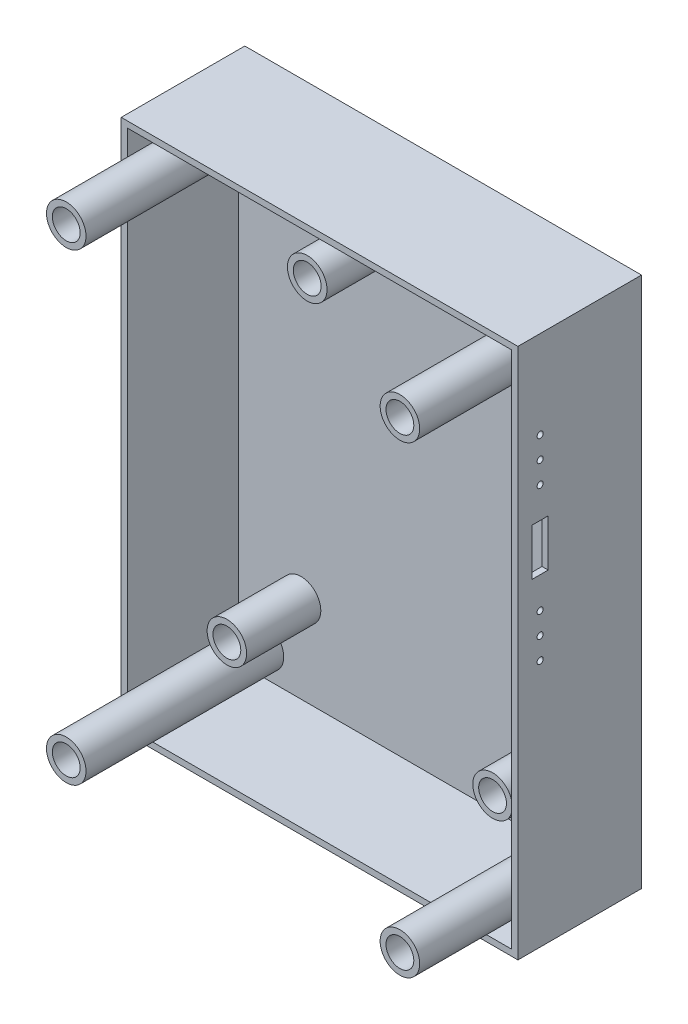
from build123d import *

# Parameters (mm, degrees)
SKETCH_1_W          = 64.2
SKETCH_1_H          = 86
EXTRUDE_1_DEPTH     = 20
SKETCH_2_W          = 62.2
SKETCH_2_H          = 84
CUT_EXTRUDE_1_DEPTH = 18
SKETCH_3_R          = 3.2
EXTRUDE_2_DEPTH     = 12
SKETCH_6_R          = 2.25
CUT_EXTRUDE_4_DEPTH = 8
SKETCH_7_R          = 3.2
EXTRUDE_3_DEPTH     = 32
SKETCH_8_R          = 2.25
CUT_EXTRUDE_5_DEPTH = 8
SKETCH_11_R         = 0.5
SKETCH_11_W         = 2.6
SKETCH_11_H         = 7.6
CUT_EXTRUDE_6_DEPTH = 2


with BuildPart() as part:
    # Эскиз1 → Бобышка-Вытянуть1 (new body)
    with BuildSketch(Plane.XY):
        Rectangle(SKETCH_1_W, SKETCH_1_H)
    extrude(amount=EXTRUDE_1_DEPTH)

    # Эскиз2 → Вырез-Вытянуть1 (cut)
    with BuildSketch(Plane.XY.offset(20)):
        Rectangle(SKETCH_2_W, SKETCH_2_H)
    extrude(amount=-CUT_EXTRUDE_1_DEPTH, mode=Mode.SUBTRACT)

    # Эскиз3 → Бобышка-Вытянуть2 (add)
    with BuildSketch(Plane.XY.offset(2)):
        with Locations((-21, -28)):
            Circle(SKETCH_3_R)
        with Locations((22, -28)):
            Circle(SKETCH_3_R)
        with Locations((19, 29.5)):
            Circle(SKETCH_3_R)
        with Locations((-8, 29.5)):
            Circle(SKETCH_3_R)
    extrude(amount=EXTRUDE_2_DEPTH)

    # Эскиз6 → Вырез-Вытянуть4 (cut)
    with BuildSketch(Plane.XY.offset(14)):
        with Locations((-21, -28)):
            Circle(SKETCH_6_R)
        with Locations((-8, 29.5)):
            Circle(SKETCH_6_R)
        with Locations((19, 29.5)):
            Circle(SKETCH_6_R)
        with Locations((22, -28)):
            Circle(SKETCH_6_R)
    extrude(amount=-CUT_EXTRUDE_4_DEPTH, mode=Mode.SUBTRACT)

    # Эскиз7 → Бобышка-Вытянуть3 (add)
    with BuildSketch(Plane.XY.offset(2)):
        with Locations((-27, -37.5)):
            Circle(SKETCH_7_R)
        with Locations((27, -37.5)):
            Circle(SKETCH_7_R)
        with Locations((-27, 37.5)):
            Circle(SKETCH_7_R)
        with Locations((27, 37.5)):
            Circle(SKETCH_7_R)
    extrude(amount=EXTRUDE_3_DEPTH)

    # Эскиз8 → Вырез-Вытянуть5 (cut)
    with BuildSketch(Plane.XY.offset(34)):
        with Locations((-27, 37.5)):
            Circle(SKETCH_8_R)
        with Locations((27, 37.5)):
            Circle(SKETCH_8_R)
        with Locations((27, -37.5)):
            Circle(SKETCH_8_R)
        with Locations((-27, -37.5)):
            Circle(SKETCH_8_R)
    extrude(amount=-CUT_EXTRUDE_5_DEPTH, mode=Mode.SUBTRACT)

    # Эскиз11 → Вырез-Вытянуть6 (cut)
    with BuildSketch(Plane(origin=(32.1, 0, 0), x_dir=(0, 0, -1), z_dir=(1, 0, 0))):
        with Locations((-16.4, 21.8)):
            Circle(SKETCH_11_R)
        with Locations((-16.4, 25.3)):
            Circle(SKETCH_11_R)
        with Locations((-16.4, 28.8)):
            Circle(SKETCH_11_R)
        with Locations((-16.4, 0.65)):
            Circle(SKETCH_11_R)
        with Locations((-16.4, 4.15)):
            Circle(SKETCH_11_R)
        with Locations((-16.4, -2.85)):
            Circle(SKETCH_11_R)
        with Locations((-16.4, 13)):
            Rectangle(SKETCH_11_W, SKETCH_11_H)
    extrude(amount=-CUT_EXTRUDE_6_DEPTH, mode=Mode.SUBTRACT)


solid = part.part
